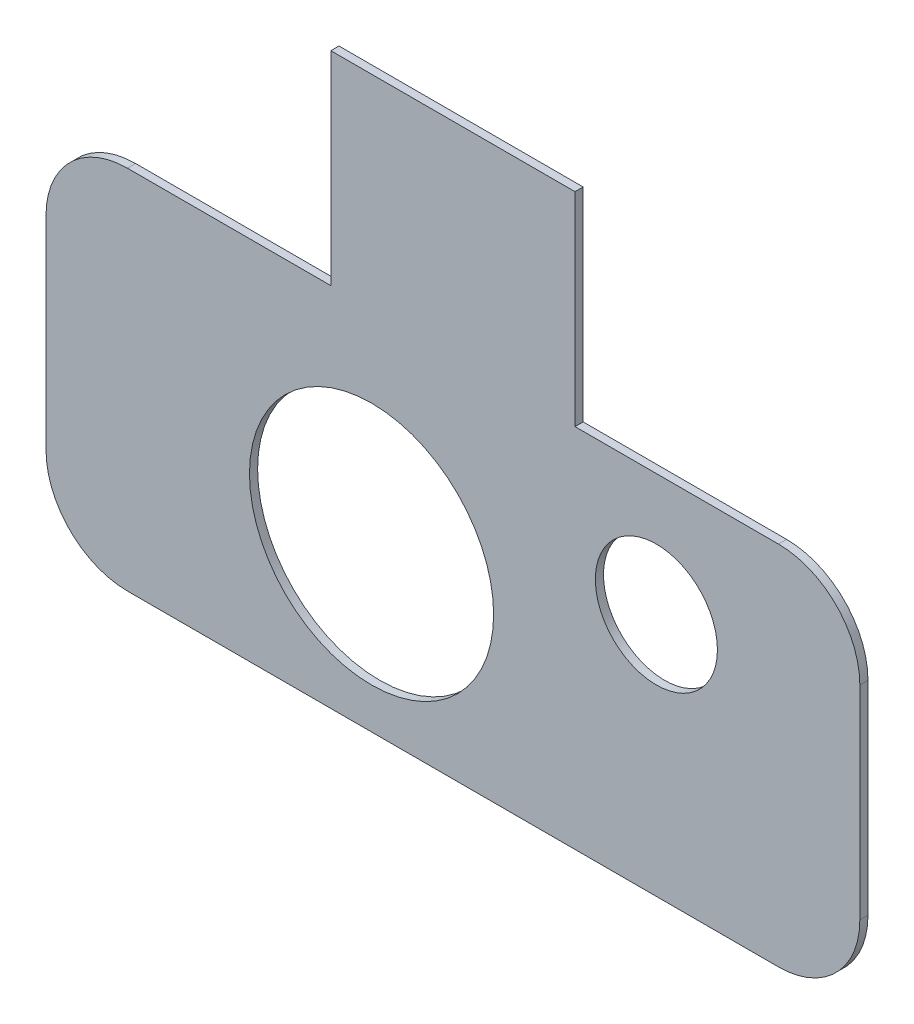
from build123d import *

# Parameters (mm, degrees)
SKETCH1_R           = 15
SKETCH1_R_2         = 7.5
BOSS_EXTRUDE1_DEPTH = 1


with BuildPart() as part:
    # Sketch1 → Boss-Extrude1 (new body)
    with BuildSketch(Plane.XY):
        with BuildLine():
            Line((-15.701917229, 8.165829146), (-15.701917229, 33.165829146))
            Line((-15.701917229, 33.165829146), (14.298082771, 33.165829146))
            Line((14.298082771, 33.165829146), (14.298082771, 8.165829146))
            Line((14.298082771, 8.165829146), (39.298082771, 8.165829146))
            ThreePointArc((39.298082771, 8.165829146), (46.369150582, 5.236896958), (49.298082771, -1.834170854))
            Line((49.298082771, -1.834170854), (49.298082771, -26.834170854))
            ThreePointArc((49.298082771, -26.834170854), (46.369150582, -33.905238666), (39.298082771, -36.834170854))
            Line((39.298082771, -36.834170854), (-40.701917229, -36.834170854))
            ThreePointArc((-40.701917229, -36.834170854), (-47.772985041, -33.905238666), (-50.701917229, -26.834170854))
            Line((-50.701917229, -26.834170854), (-50.701917229, -1.834170854))
            ThreePointArc((-50.701917229, -1.834170854), (-47.772985041, 5.236896958), (-40.701917229, 8.165829146))
            Line((-40.701917229, 8.165829146), (-15.701917229, 8.165829146))
        make_face()
        with Locations((-10.701917229, -16.834170854)):
            Circle(SKETCH1_R, mode=Mode.SUBTRACT)
        with Locations((24.298082771, -6.834170854)):
            Circle(SKETCH1_R_2, mode=Mode.SUBTRACT)
    extrude(amount=BOSS_EXTRUDE1_DEPTH)


solid = part.part
